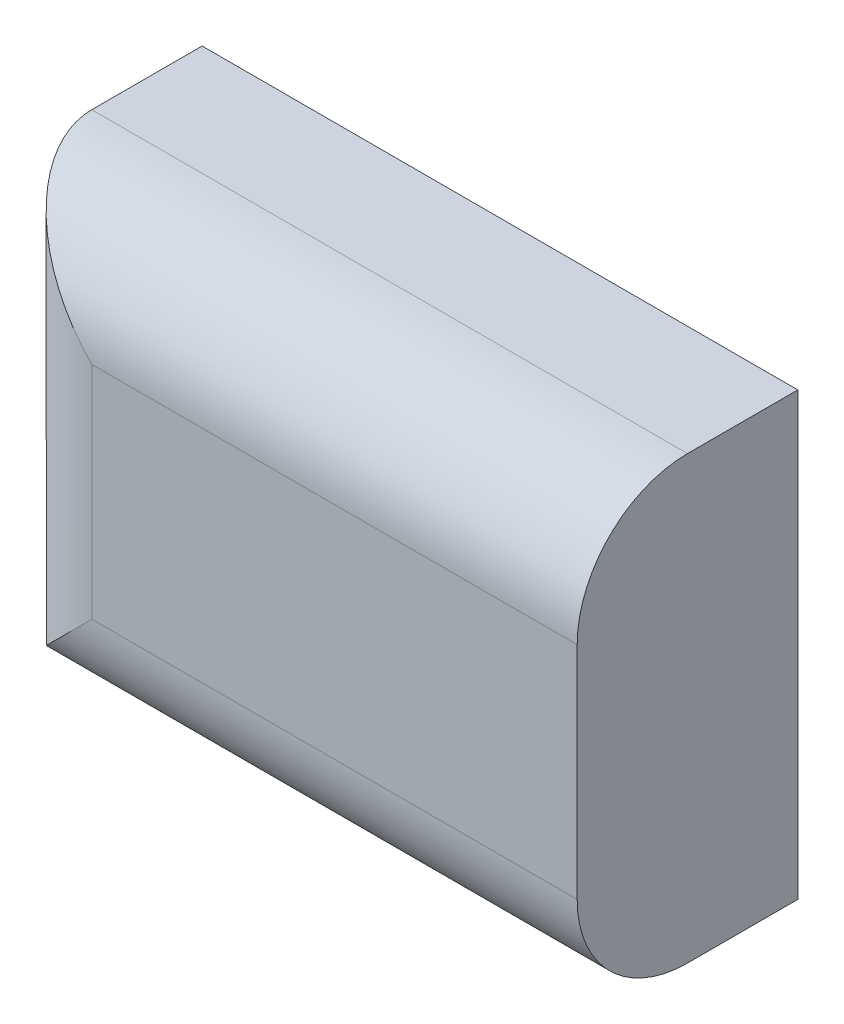
from build123d import *

# Parameters (mm, degrees)
SKETCH1_W           = 63.5
SKETCH1_H           = 127
BOSS_EXTRUDE1_DEPTH = 171.45
FILLET1_R           = 31.75


with BuildPart() as part:
    # Sketch1 → Boss-Extrude1 (new body)
    with BuildSketch(Plane(origin=(0, 0, 0), x_dir=(0, 0, -1), z_dir=(1, 0, 0))):
        with Locations((-5.766791516, 21.358919545)):
            Rectangle(SKETCH1_W, SKETCH1_H)
    extrude(amount=BOSS_EXTRUDE1_DEPTH)

    # Fillet1
    fillet1_edges = [part.edges().sort_by_distance(p)[0] for p in [
        (0, 21.358919545, 37.516791516),
        (85.725, 84.858919545, 37.516791516),
        (85.725, -42.141080455, 37.516791516),
    ]]
    fillet(fillet1_edges, radius=FILLET1_R)


solid = part.part
